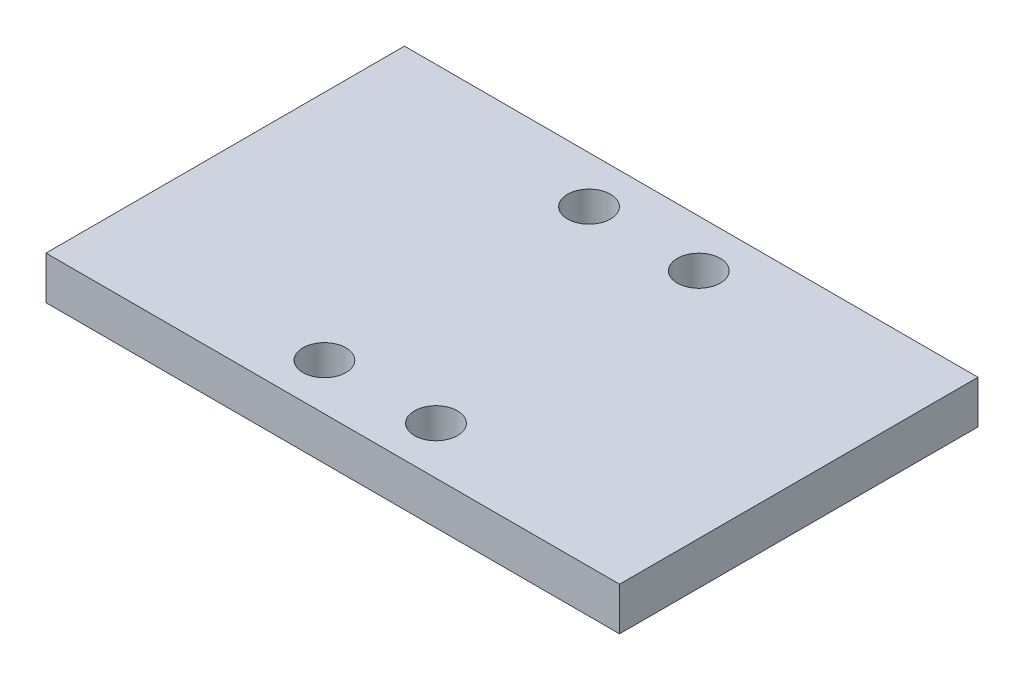
from build123d import *

# Parameters (mm, degrees)
SKETCH1_W           = 40
SKETCH1_H           = 25
BOSS_EXTRUDE1_DEPTH = 3
SKETCH2_R           = 1.5
CUT_EXTRUDE1_DEPTH  = 24.774986856


with BuildPart() as part:
    # Sketch1 → Boss-Extrude1 (new body)
    with BuildSketch(Plane(origin=(0, 0, 0), x_dir=(1, 0, 0), z_dir=(0, 1, 0))):
        Rectangle(SKETCH1_W, SKETCH1_H)
    extrude(amount=BOSS_EXTRUDE1_DEPTH)

    # Sketch2 → Cut-Extrude1 (cut, through all)
    with BuildSketch(Plane.XZ):
        with Locations(Location((-3.868471685, -9.240568852, 0), (0, 0, 270))):
            Circle(SKETCH2_R)
        with Locations(Location((3.831281025, -9.196933199, 0), (0, 0, 90))):
            Circle(SKETCH2_R)
        with Locations(Location((3.876664556, 9.177895536, 0), (0, 0, 270))):
            Circle(SKETCH2_R)
        with Locations(Location((-3.822778666, 9.259565279, 0), (0, 0, 90))):
            Circle(SKETCH2_R)
    extrude(amount=-CUT_EXTRUDE1_DEPTH, mode=Mode.SUBTRACT)


solid = part.part
